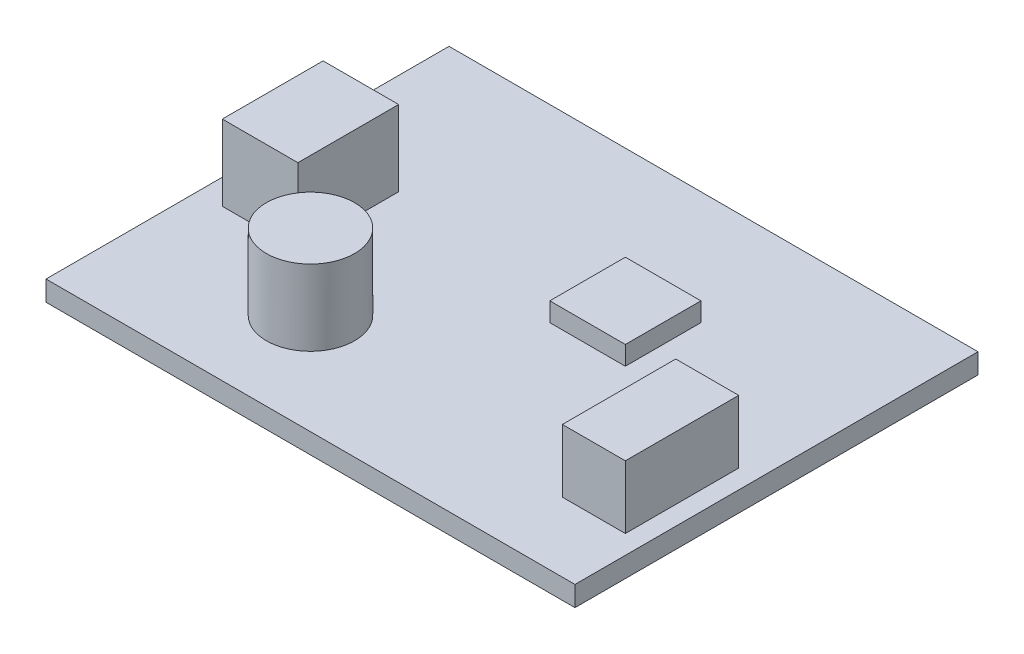
from build123d import *

# Parameters (mm, degrees)
SKETCH1_W             = 42
SKETCH1_H             = 32
PCB_DEPTH             = 1.6
IC_START              = 1.6
SKETCH2_W             = 6
SKETCH2_H             = 6
IC_DEPTH              = 1.5
OUT_CONNECTOR_START   = 1.6
SKETCH3_W             = 5
SKETCH3_H             = 9
OUT_CONNECTOR_DEPTH   = 5
PROBE_CONNECTOR_START = 1.6
SKETCH4_W             = 6
SKETCH4_H             = 8
PROBE_CONNECTOR_DEPTH = 6
TRIM_POT_START        = 1.6
SKETCH5_R             = 3.5
TRIM_POT_DEPTH        = 6


with BuildPart() as part:
    # Sketch1 → PCB (new body)
    with BuildSketch(Plane(origin=(0, 0, 0), x_dir=(1, 0, 0), z_dir=(0, 1, 0))):
        Rectangle(SKETCH1_W, SKETCH1_H)
    extrude(amount=PCB_DEPTH)

    # Sketch2 → IC (add)
    with BuildSketch(Plane(origin=(0, 0, 0), x_dir=(1, 0, 0), z_dir=(0, 1, 0)).offset(IC_START)):
        with Locations((5, 4)):
            Rectangle(SKETCH2_W, SKETCH2_H)
    extrude(amount=IC_DEPTH)

    # Sketch3 → Out_Connector (add)
    with BuildSketch(Plane(origin=(0, 0, 0), x_dir=(1, 0, 0), z_dir=(0, 1, 0)).offset(OUT_CONNECTOR_START)):
        with Locations((17, -6)):
            Rectangle(SKETCH3_W, SKETCH3_H)
    extrude(amount=OUT_CONNECTOR_DEPTH)

    # Sketch4 → Probe_Connector (add)
    with BuildSketch(Plane(origin=(0, 0, 0), x_dir=(1, 0, 0), z_dir=(0, 1, 0)).offset(PROBE_CONNECTOR_START)):
        with Locations((-16, 0)):
            Rectangle(SKETCH4_W, SKETCH4_H)
    extrude(amount=PROBE_CONNECTOR_DEPTH)

    # Sketch5 → Trim_Pot (add)
    with BuildSketch(Plane(origin=(0, 0, 0), x_dir=(1, 0, 0), z_dir=(0, 1, 0)).offset(TRIM_POT_START)):
        with Locations(Location((-8, -8, 0), (0, 0, 90))):
            Circle(SKETCH5_R)
    extrude(amount=TRIM_POT_DEPTH)


solid = part.part
